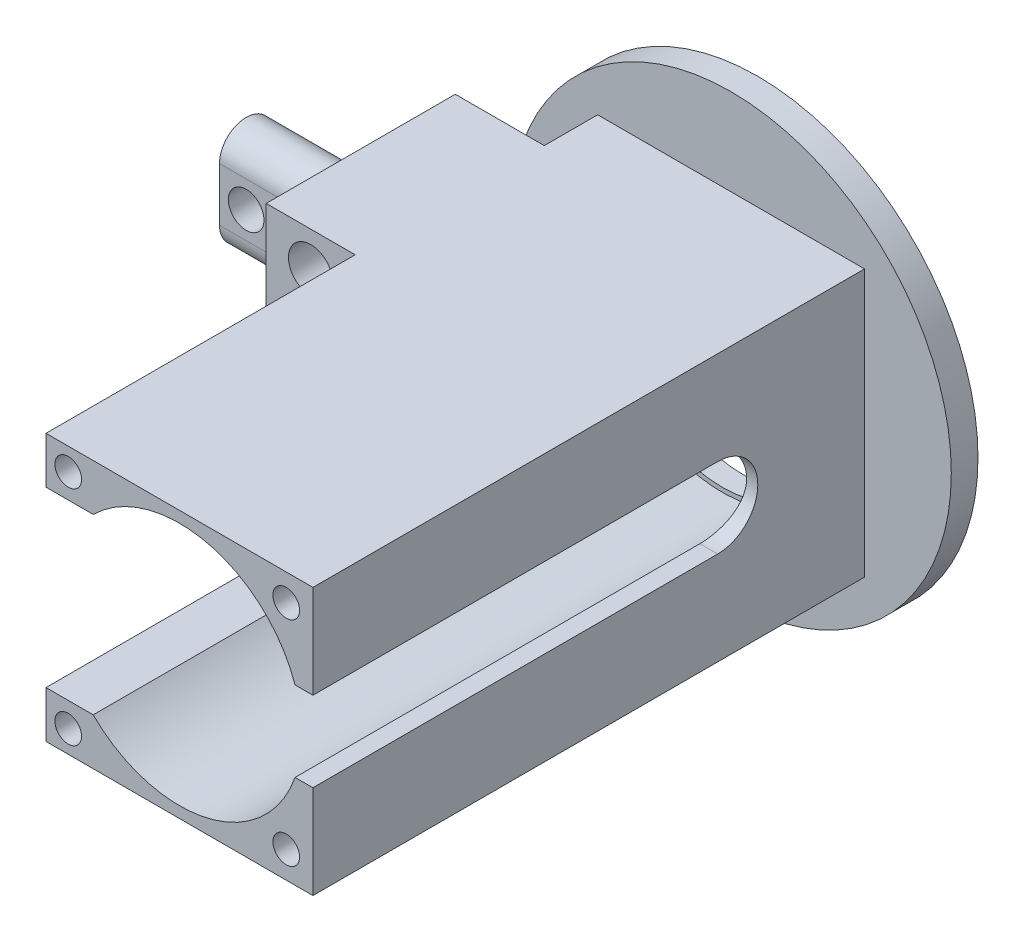
from build123d import *

# Parameters (mm, degrees)
SKETCH1_W                = 30
SKETCH1_H                = 30
BOSS_EXTRUDE1_DEPTH      = 65
SKETCH2_R                = 24.75
BOSS_EXTRUDE2_DEPTH      = 3
SKETCH3_R                = 23.75
CUT_EXTRUDE1_DEPTH       = 1.6
CUT_EXTRUDE4_REACH       = 74.42
SKETCH4_R                = 13.25
SKETCH5_R                = 13.75
CUT_EXTRUDE5_DEPTH       = 61
CUT_EXTRUDE9_REACH       = 82.11
CUT_EXTRUDE9_END_RADIUS  = 13.75
SKETCH8_W                = 10
SKETCH8_H                = 20
BOSS_EXTRUDE3_DEPTH      = 10
BOSS_EXTRUDE4_DEPTH      = 18.5
CUT_EXTRUDE10_REACH      = 71.346
SKETCH10_R               = 2
CUT_EXTRUDE11_REACH      = 82.11
CUT_EXTRUDE11_END_RADIUS = 13.75
CUT_EXTRUDE12_REACH      = 81.679
SKETCH13_W               = 15
SKETCH13_H               = 7
SKETCH14_W               = 11.25
SKETCH14_H               = 20
BOSS_EXTRUDE5_DEPTH      = 10
SKETCH15_W               = 21.25
SKETCH15_H               = 5
BOSS_EXTRUDE6_DEPTH      = 10
SKETCH16_W               = 10
SKETCH16_H               = 21.25
BOSS_EXTRUDE7_DEPTH      = 5
SKETCH18_R               = 2.5
CUT_EXTRUDE13_DEPTH      = 5.5
SKETCH19_R               = 1.5
CUT_EXTRUDE14_DEPTH      = 3.5
SKETCH20_R               = 1.5
CUT_EXTRUDE15_DEPTH      = 3.5


with BuildPart() as part:
    # Sketch1 → Boss-Extrude1 (new body)
    with BuildSketch(Plane.XY):
        Rectangle(SKETCH1_W, SKETCH1_H)
    extrude(amount=BOSS_EXTRUDE1_DEPTH)

    # Sketch2 → Boss-Extrude2 (add)
    with BuildSketch(Plane(origin=(0, 0, 0), x_dir=(-1, 0, 0), z_dir=(0, 0, -1))):
        Circle(SKETCH2_R)
    extrude(amount=-BOSS_EXTRUDE2_DEPTH)

    # Sketch3 → Cut-Extrude1 (cut)
    with BuildSketch(Plane(origin=(0, 0, 0), x_dir=(-1, 0, 0), z_dir=(0, 0, -1))):
        Circle(SKETCH3_R)
    extrude(amount=-CUT_EXTRUDE1_DEPTH, mode=Mode.SUBTRACT)

    # Sketch4 → Cut-Extrude4 (cut, up to next)
    with BuildSketch(Plane(origin=(0, 0, 1.6), x_dir=(-1, 0, 0), z_dir=(0, 0, -1)), mode=Mode.PRIVATE) as cut_extrude4_sk1:
        Circle(SKETCH4_R)
    cut_extrude4_tool1 = extrude(cut_extrude4_sk1.sketch, amount=-CUT_EXTRUDE4_REACH, mode=Mode.PRIVATE) & part.part
    add(cut_extrude4_tool1.solids().sort_by_distance((0, 0, 1.6))[0], mode=Mode.SUBTRACT)

    # Sketch5 → Cut-Extrude5 (cut)
    with BuildSketch(Plane.XY.offset(65)):
        Circle(SKETCH5_R)
    extrude(amount=-CUT_EXTRUDE5_DEPTH, mode=Mode.SUBTRACT)

    # Cut-Extrude9: up to this cylinder (the profile starts outside it)
    cut_extrude9_end = Plane(origin=(0, 0, 42.25), z_dir=(0, 0, 1)) * Cylinder(CUT_EXTRUDE9_END_RADIUS, 192.72, mode=Mode.PRIVATE)
    # Sketch6 → Cut-Extrude9 (cut, up to the surface)
    with BuildSketch(Plane(origin=(15, 0, 0), x_dir=(0, 0, -1), z_dir=(1, 0, 0)), mode=Mode.PRIVATE) as cut_extrude9_sk1:
        with BuildLine():
            Line((-19.5, -4.5), (-65, -4.5))
            ThreePointArc((-65, -4.5), (-69.5, 0), (-65, 4.5))
            Line((-65, 4.5), (-19.5, 4.5))
            ThreePointArc((-19.5, 4.5), (-15, 0), (-19.5, -4.5))
        make_face()
    cut_extrude9_tool1 = extrude(cut_extrude9_sk1.sketch, amount=-CUT_EXTRUDE9_REACH, mode=Mode.PRIVATE) - cut_extrude9_end
    add(cut_extrude9_tool1.solids().sort_by_distance((15, 0, 42.25))[0], mode=Mode.SUBTRACT)

    # Sketch8 → Boss-Extrude3 (add)
    with BuildSketch(Plane.ZY.offset(15)):
        with Locations((14, 0)):
            Rectangle(SKETCH8_W, SKETCH8_H)
    extrude(amount=BOSS_EXTRUDE3_DEPTH)

    # Sketch9 → Boss-Extrude4 (add)
    with BuildSketch(Plane.ZY.offset(25)):
        with BuildLine():
            Line((17, 3), (17, -3))
            ThreePointArc((17, -3), (14, -6), (11, -3))
            Line((11, -3), (11, 3))
            ThreePointArc((11, 3), (14, 6), (17, 3))
        make_face()
    extrude(amount=BOSS_EXTRUDE4_DEPTH)

    # Sketch10 → Cut-Extrude10 (cut, up to next)
    with BuildSketch(Plane.XY.offset(17), mode=Mode.PRIVATE) as cut_extrude10_sk1:
        with Locations((-40.5, 0)):
            Circle(SKETCH10_R)
    cut_extrude10_tool1 = extrude(cut_extrude10_sk1.sketch, amount=-CUT_EXTRUDE10_REACH, mode=Mode.PRIVATE) & part.part
    # Sketch10 → Cut-Extrude10 (cut, up to next)
    with BuildSketch(Plane.XY.offset(17), mode=Mode.PRIVATE) as cut_extrude10_sk2:
        with Locations((-32, 0)):
            Circle(SKETCH10_R)
    cut_extrude10_tool2 = extrude(cut_extrude10_sk2.sketch, amount=-CUT_EXTRUDE10_REACH, mode=Mode.PRIVATE) & part.part
    add(cut_extrude10_tool1.solids().sort_by_distance((-40.5, 0, 17))[0], mode=Mode.SUBTRACT)
    add(cut_extrude10_tool2.solids().sort_by_distance((-32, 0, 17))[0], mode=Mode.SUBTRACT)

    # Cut-Extrude11: up to this cylinder (the profile starts outside it)
    cut_extrude11_end = Plane(origin=(0, 0, 52.5), z_dir=(0, 0, 1)) * Cylinder(CUT_EXTRUDE11_END_RADIUS, 192.72, mode=Mode.PRIVATE)
    # Sketch11 → Cut-Extrude11 (cut, up to the surface)
    with BuildSketch(Plane.ZY.offset(15), mode=Mode.PRIVATE) as cut_extrude11_sk1:
        with BuildLine():
            Line((40, 9.75), (65, 9.75))
            ThreePointArc((65, 9.75), (74.75, 0), (65, -9.75))
            Line((65, -9.75), (40, -9.75))
            ThreePointArc((40, -9.75), (30.25, 0), (40, 9.75))
        make_face()
    cut_extrude11_tool1 = extrude(cut_extrude11_sk1.sketch, amount=-CUT_EXTRUDE11_REACH, mode=Mode.PRIVATE) - cut_extrude11_end
    add(cut_extrude11_tool1.solids().sort_by_distance((-15, 0, 52.5))[0], mode=Mode.SUBTRACT)

    # Sketch13 → Cut-Extrude12 (cut, up to next)
    with BuildSketch(Plane.XY.offset(3), mode=Mode.PRIVATE) as cut_extrude12_sk1:
        with Locations((0, -18.5)):
            Rectangle(SKETCH13_W, SKETCH13_H)
    cut_extrude12_tool1 = extrude(cut_extrude12_sk1.sketch, amount=-CUT_EXTRUDE12_REACH, mode=Mode.PRIVATE) & part.part
    add(cut_extrude12_tool1.solids().sort_by_distance((0, -18.5, 3))[0], mode=Mode.SUBTRACT)

    # Sketch14 → Boss-Extrude5 (add)
    with BuildSketch(Plane.ZY.offset(15)):
        with Locations((24.625, 0)):
            Rectangle(SKETCH14_W, SKETCH14_H)
    extrude(amount=BOSS_EXTRUDE5_DEPTH)

    # Sketch15 → Boss-Extrude6 (add)
    with BuildSketch(Plane.ZY.offset(15)):
        with Locations((19.625, 12.5)):
            Rectangle(SKETCH15_W, SKETCH15_H)
    extrude(amount=BOSS_EXTRUDE6_DEPTH)

    # Sketch16 → Boss-Extrude7 (add)
    with BuildSketch(Plane(origin=(0, -10, 0), x_dir=(-1, 0, 0), z_dir=(0, -1, 0))):
        with Locations((20, -19.625)):
            Rectangle(SKETCH16_W, SKETCH16_H)
    extrude(amount=BOSS_EXTRUDE7_DEPTH)

    # Sketch18 → Cut-Extrude13 (cut)
    with BuildSketch(Plane.XY.offset(30.25)):
        with Locations((-20, -11)):
            Circle(SKETCH18_R)
        with Locations((-20, 11)):
            Circle(SKETCH18_R)
    extrude(amount=-CUT_EXTRUDE13_DEPTH, mode=Mode.SUBTRACT)

    # Sketch19 → Cut-Extrude14 (cut)
    with BuildSketch(Plane.XY.offset(65)):
        with Locations((12, -12)):
            Circle(SKETCH19_R)
        with Locations((12, 12)):
            Circle(SKETCH19_R)
        with Locations((-12.5, -12.5)):
            Circle(SKETCH19_R)
        with Locations((-12.5, 12.5)):
            Circle(SKETCH19_R)
    extrude(amount=-CUT_EXTRUDE14_DEPTH, mode=Mode.SUBTRACT)

    # Sketch20 → Cut-Extrude15 (cut)
    with BuildSketch(Plane.ZY.offset(25)):
        with Locations((14, 11)):
            Circle(SKETCH20_R)
        with Locations((14, -11)):
            Circle(SKETCH20_R)
    extrude(amount=-CUT_EXTRUDE15_DEPTH, mode=Mode.SUBTRACT)


solid = part.part
